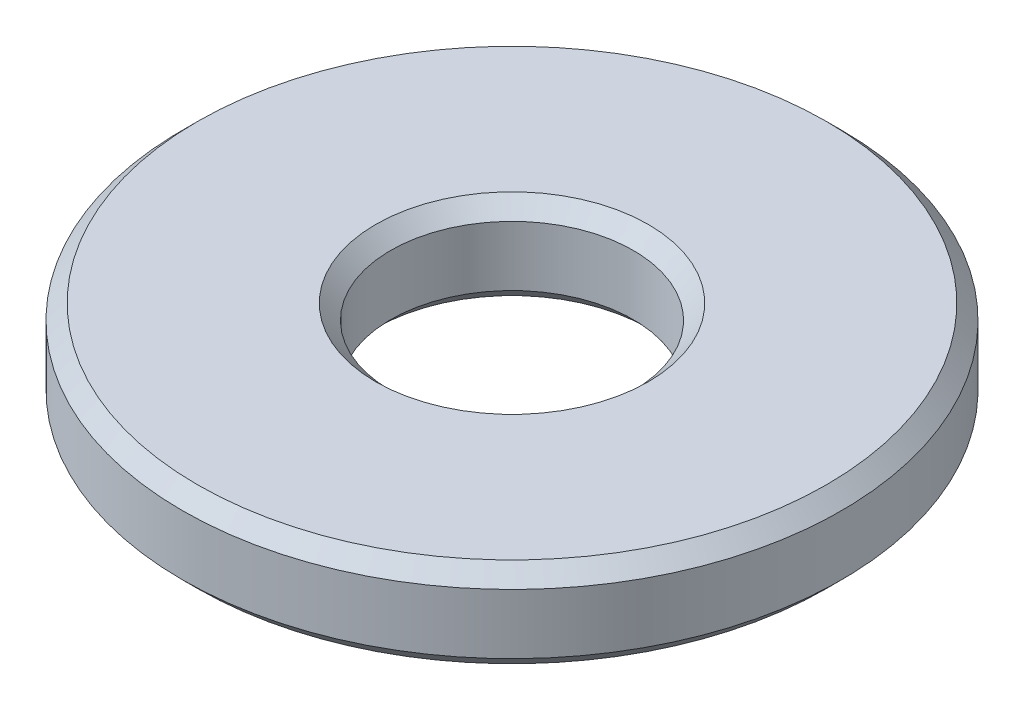
from build123d import *

# Parameters (mm, degrees)
SKETCH1_R           = 11
SKETCH1_R_2         = 4.05
BOSS_EXTRUDE1_DEPTH = 1.5
CHAMFER1_SIZE       = 0.5


with BuildPart() as part:
    # Sketch1 → Boss-Extrude1 (new, symmetric)
    with BuildSketch(Plane(origin=(0, 0, 0), x_dir=(1, 0, 0), z_dir=(0, 1, 0))):
        with Locations(Location((0, 0, 0), (0, 0, 270))):
            Circle(SKETCH1_R)
        with Locations(Location((0, 0, 0), (0, 0, 270))):
            Circle(SKETCH1_R_2, mode=Mode.SUBTRACT)
    extrude(amount=BOSS_EXTRUDE1_DEPTH, both=True)

    # Chamfer1
    chamfer1_edges = [part.edges().sort_by_distance(p)[0] for p in [
        (0, -1.5, -11),
        (0, 1.5, -11),
        (0, -1.5, -4.05),
        (0, 1.5, -4.05),
    ]]
    chamfer(chamfer1_edges, length=CHAMFER1_SIZE)


solid = part.part
